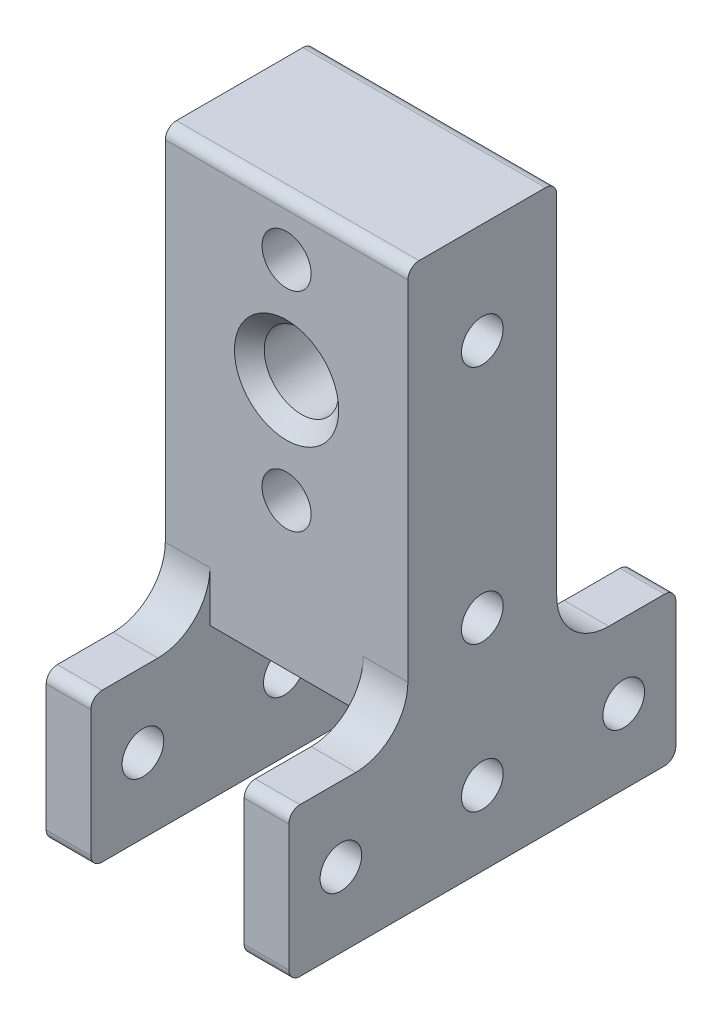
from build123d import *

# Parameters (mm, degrees)
EXTRUDE1_DEPTH      = 10.3
EXTRUDE1_DEPTH_BACK = 10.3
SKETCH1_W           = 20
SKETCH1_H           = 55
EXTRUDE2_DEPTH      = 6
SKETCH4_R           = 2.8
EXTRUDE3_DEPTH      = 78.478061411
SKETCH5_R           = 5
EXTRUDE4_DEPTH      = 77.326797391
FILLET2_R           = 1.5
CHAMFER1_SIZE       = 2
SKETCH7_R           = 1.95
EXTRUDE5_DEPTH      = 77.326797413
SKETCH8_R           = 3.3
EXTRUDE6_DEPTH      = 8


with BuildPart() as part:
    # Sketch1 → Extrude1 (new, two sides: drawn at the far end of the back side and taken through both)
    with BuildSketch(Plane(origin=(0, 0, 0), x_dir=(0, 0, -1), z_dir=(1, 0, 0)).offset(-EXTRUDE1_DEPTH_BACK)):
        with Locations((0, 37.8)):
            Rectangle(SKETCH1_W, SKETCH1_H)
    extrude(amount=EXTRUDE1_DEPTH + EXTRUDE1_DEPTH_BACK)

    # Sketch2 → Extrude2 (add)
    with BuildSketch(Plane(origin=(10.3, 0, 0), x_dir=(0, 0, -1), z_dir=(1, 0, 0))):
        with BuildLine():
            Line((26, 10), (17, 10))
            ThreePointArc((17, 10), (12.050252532, 12.050252532), (10, 17))
            Line((10, 17), (10, 65.3))
            Line((10, 65.3), (-10, 65.3))
            Line((-10, 65.3), (-10, 17))
            ThreePointArc((-10, 17), (-12.050252532, 12.050252532), (-17, 10))
            Line((-17, 10), (-26, 10))
            Line((-26, 10), (-26, -10))
            Line((-26, -10), (26, -10))
            Line((26, -10), (26, 10))
        make_face()
    extrude2 = extrude(amount=EXTRUDE2_DEPTH)

    # Mirror2: Extrude2 across plane
    add(extrude2.mirror(Plane(origin=(0, 0, 0), x_dir=(0, 0, 1), z_dir=(1, 0, 0))))

    # Sketch4 → Extrude3 (cut, through all)
    with BuildSketch(Plane(origin=(16.3, 0, 0), x_dir=(0, 0, -1), z_dir=(1, 0, 0))):
        Circle(SKETCH4_R)
        with Locations((19, 0)):
            Circle(SKETCH4_R)
        with Locations((-19, 0)):
            Circle(SKETCH4_R)
        with Locations((0, 19.5)):
            Circle(SKETCH4_R)
        with Locations((0, 51.75)):
            Circle(SKETCH4_R)
    extrude(amount=-EXTRUDE3_DEPTH, mode=Mode.SUBTRACT)

    # Sketch5 → Extrude4 (cut, through all)
    with BuildSketch(Plane.XY.offset(10)):
        with Locations((0, 44)):
            Circle(SKETCH5_R)
    extrude(amount=-EXTRUDE4_DEPTH, mode=Mode.SUBTRACT)

    # Fillet2
    fillet2_edges = [part.edges().sort_by_distance(p)[0] for p in [
        (13.3, 10, 26),
        (13.3, -10, 26),
        (13.3, -10, -26),
        (13.3, 10, -26),
        (-13.3, -10, 26),
        (-13.3, 10, 26),
        (-13.3, 10, -26),
        (-13.3, -10, -26),
        (0, 65.3, 10),
        (0, 65.3, -10),
    ]]
    fillet(fillet2_edges, radius=FILLET2_R)

    # Chamfer1
    chamfer1_edges = [part.edges().sort_by_distance(p)[0] for p in [
        (-5, 44, -10),
        (-5, 44, 10),
    ]]
    chamfer(chamfer1_edges, length=CHAMFER1_SIZE)

    # Sketch7 → Extrude5 (cut, through all)
    with BuildSketch(Plane.XY.offset(10)):
        with Locations((0, 58)):
            Circle(SKETCH7_R)
        with Locations((0, 30)):
            Circle(SKETCH7_R)
    extrude(amount=-EXTRUDE5_DEPTH, mode=Mode.SUBTRACT)

    # Sketch8 → Extrude6 (cut)
    with BuildSketch(Plane.XY.offset(10)):
        with Locations((0, 58)):
            Circle(SKETCH8_R)
        with Locations((0, 30)):
            Circle(SKETCH8_R)
    extrude(amount=-EXTRUDE6_DEPTH, mode=Mode.SUBTRACT)


solid = part.part
